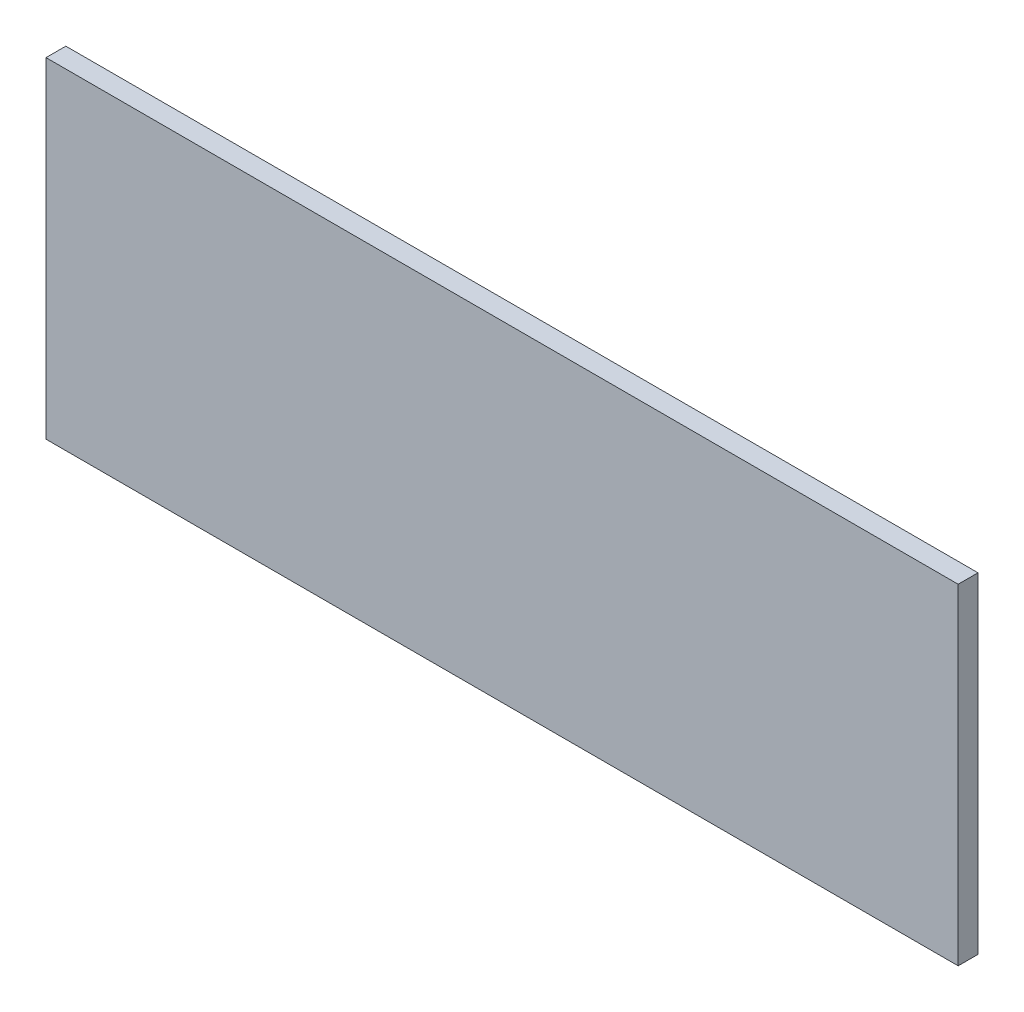
from build123d import *

# Parameters (mm, degrees)
CROQUIS1_W              = 1380
CROQUIS1_H              = 500
SALIENTE_EXTRUIR1_DEPTH = 30
CROQUIS2_R              = 40
CROQUIS2_W              = 210
CROQUIS2_H              = 297
CORTAR_EXTRUIR3_DEPTH   = 10


with BuildPart() as part:
    # Croquis1 → Saliente-Extruir1 (new body)
    with BuildSketch(Plane.XY):
        Rectangle(CROQUIS1_W, CROQUIS1_H)
    extrude(amount=SALIENTE_EXTRUIR1_DEPTH)

    # Croquis2 → Cortar-Extruir3 (cut)
    with BuildSketch(Plane(origin=(0, 0, 0), x_dir=(-1, 0, 0), z_dir=(0, 0, -1))):
        with Locations((-256.532724235, 167.997980694)):
            Circle(CROQUIS2_R)
        with Locations((-532.122165127, 59.369001894)):
            Rectangle(CROQUIS2_W, CROQUIS2_H)
    extrude(amount=-CORTAR_EXTRUIR3_DEPTH, mode=Mode.SUBTRACT)


solid = part.part
